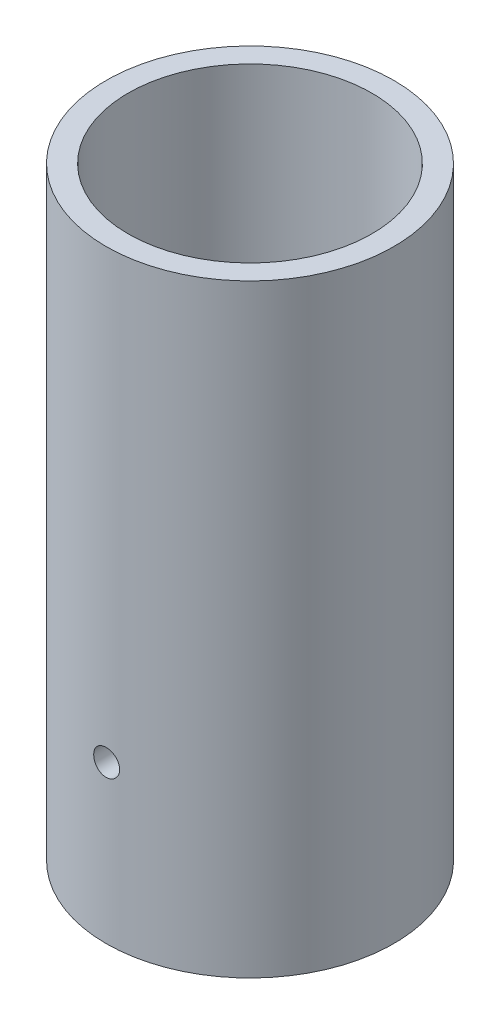
from build123d import *

# Parameters (mm, degrees)
SKETCH1_R               = 30.275
SKETCH1_R_2             = 25.65
BOSS_EXTRUDE1_DEPTH     = 127
CUT_EXTRUDE1_DEPTH      = 135.02295046
CUT_EXTRUDE1_DEPTH_BACK = 135.02295046
SKETCH2_R               = 2.7305


with BuildPart() as part:
    # Sketch1 → Boss-Extrude1 (new body)
    with BuildSketch(Plane(origin=(0, 0, 0), x_dir=(1, 0, 0), z_dir=(0, 1, 0))):
        with Locations(Location((0, 0, 0), (0, 0, 270))):
            Circle(SKETCH1_R)
        with Locations(Location((0, 0, 0), (0, 0, 270))):
            Circle(SKETCH1_R_2, mode=Mode.SUBTRACT)
    extrude(amount=BOSS_EXTRUDE1_DEPTH)

    # Sketch2 → Cut-Extrude1 (cut, two sides: drawn at the far end of the back side and taken through both)
    with BuildSketch(Plane.XY.offset(-CUT_EXTRUDE1_DEPTH_BACK)):
        with Locations((0, 33.02)):
            Circle(SKETCH2_R)
    extrude(amount=CUT_EXTRUDE1_DEPTH + CUT_EXTRUDE1_DEPTH_BACK, mode=Mode.SUBTRACT)


solid = part.part
